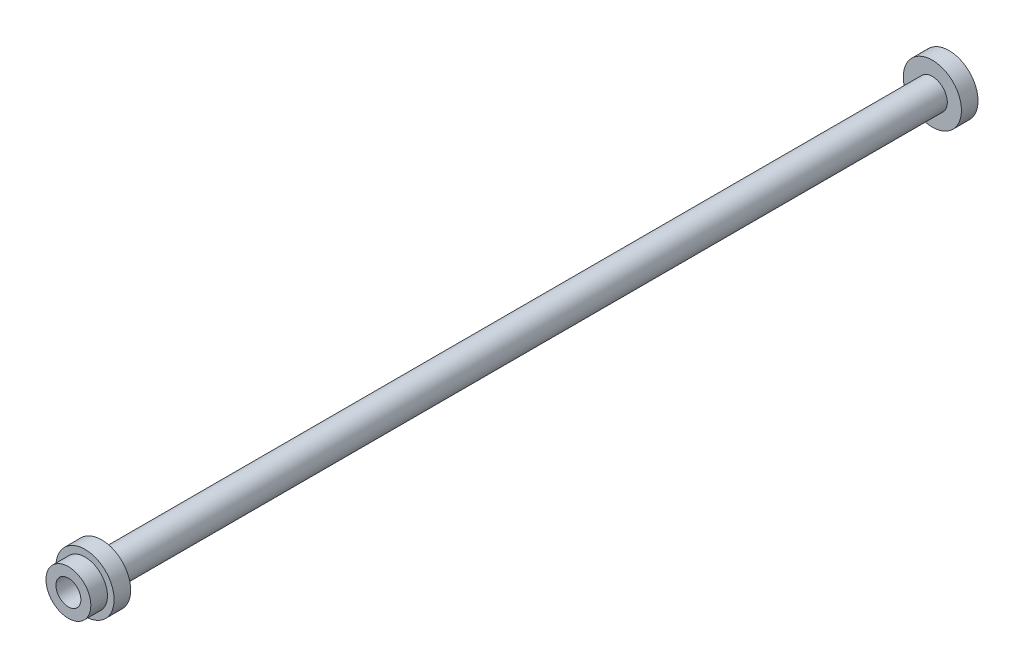
from build123d import *

# Parameters (mm, degrees)
SKETCH1_R           = 9
SKETCH1_R_2         = 7.5
BOSS_EXTRUDE1_DEPTH = 530
SKETCH2_R           = 17.5
SKETCH2_R_2         = 7.5
BOSS_EXTRUDE2_DEPTH = 10
BOSS_EXTRUDE3_START = -20
SKETCH3_R           = 17.5
SKETCH3_R_2         = 7.5
BOSS_EXTRUDE3_DEPTH = 20
CUT_EXTRUDE1_START  = -10
SKETCH4_R           = 17.5
SKETCH4_R_2         = 13.5
CUT_EXTRUDE1_DEPTH  = 10


with BuildPart() as part:
    # Sketch1 → Boss-Extrude1 (new body)
    with BuildSketch(Plane.XY):
        Circle(SKETCH1_R)
        Circle(SKETCH1_R_2, mode=Mode.SUBTRACT)
    extrude(amount=BOSS_EXTRUDE1_DEPTH)

    # Sketch2 → Boss-Extrude2 (add)
    with BuildSketch(Plane(origin=(0, 0, 0), x_dir=(-1, 0, 0), z_dir=(0, 0, -1))):
        Circle(SKETCH2_R)
        with Locations(Location((0, 0, 0), (0, 0, 180))):
            Circle(SKETCH2_R_2, mode=Mode.SUBTRACT)
    extrude(amount=-BOSS_EXTRUDE2_DEPTH)

    # Sketch3 → Boss-Extrude3 (add)
    with BuildSketch(Plane.XY.offset(530).offset(BOSS_EXTRUDE3_START)):
        with Locations(Location((0, 0, 0), (0, 0, 180))):
            Circle(SKETCH3_R)
        Circle(SKETCH3_R_2, mode=Mode.SUBTRACT)
    extrude(amount=BOSS_EXTRUDE3_DEPTH)

    # Sketch4 → Cut-Extrude1 (cut)
    with BuildSketch(Plane.XY.offset(530).offset(CUT_EXTRUDE1_START)):
        Circle(SKETCH4_R)
        Circle(SKETCH4_R_2, mode=Mode.SUBTRACT)
    extrude(amount=CUT_EXTRUDE1_DEPTH, mode=Mode.SUBTRACT)


solid = part.part
